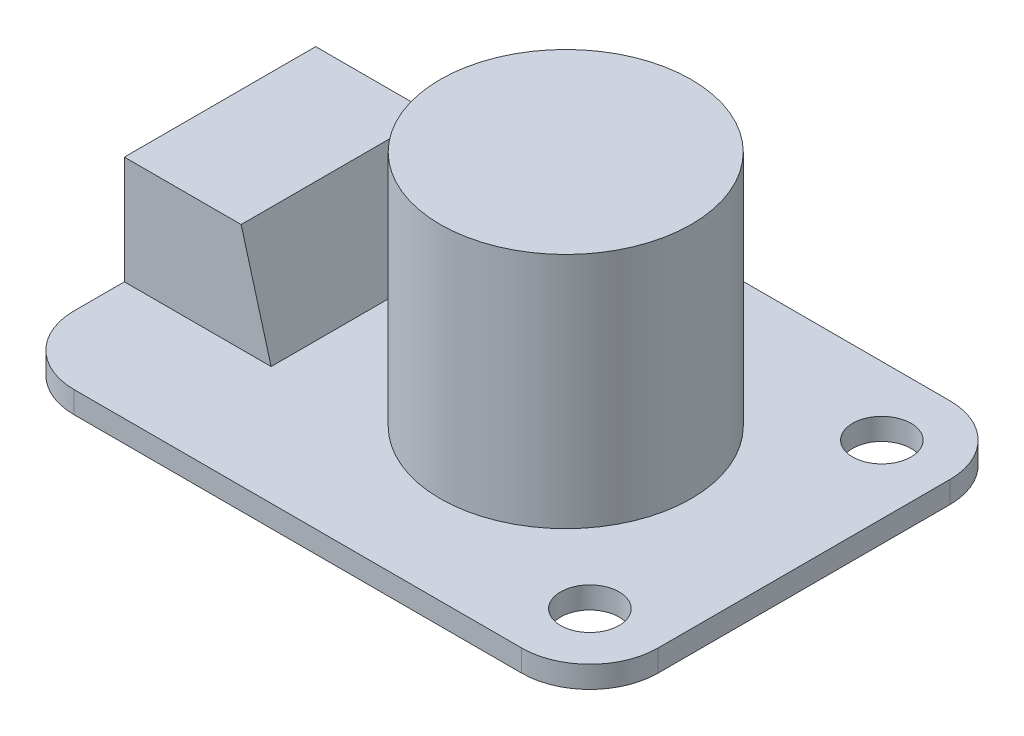
from build123d import *

# Parameters (mm, degrees)
SKETCH1_R           = 1.5
BOSS_EXTRUDE1_DEPTH = 1.12
SKETCH2_W           = 6
SKETCH2_H           = 9.83
BOSS_EXTRUDE2_DEPTH = 5.55
BOSS_EXTRUDE3_DEPTH = 9.83
SKETCH4_R           = 6.45
BOSS_EXTRUDE4_DEPTH = 12.2


with BuildPart() as part:
    # Sketch1 → Boss-Extrude1 (new body)
    with BuildSketch(Plane(origin=(0, 0, 0), x_dir=(1, 0, 0), z_dir=(0, 1, 0))):
        with BuildLine():
            Line((3.5, 0), (26.5, 0))
            ThreePointArc((26.5, 0), (28.974873734, 1.025126266), (30, 3.5))
            Line((30, 3.5), (30, 18.5))
            ThreePointArc((30, 18.5), (28.974873734, 20.974873734), (26.5, 22))
            Line((26.5, 22), (3.5, 22))
            ThreePointArc((3.5, 22), (1.025126266, 20.974873734), (0, 18.5))
            Line((0, 18.5), (0, 3.5))
            ThreePointArc((0, 3.5), (1.025126266, 1.025126266), (3.5, 0))
        make_face()
        with Locations(Location((26.5, 18.5, 0), (0, 0, 270))):
            Circle(SKETCH1_R, mode=Mode.SUBTRACT)
        with Locations(Location((26.5, 3.5, 0), (0, 0, 270))):
            Circle(SKETCH1_R, mode=Mode.SUBTRACT)
    extrude(amount=BOSS_EXTRUDE1_DEPTH)

    # Sketch2 → Boss-Extrude2 (add)
    with BuildSketch(Plane(origin=(0, 1.12, 0), x_dir=(1, 0, 0), z_dir=(0, 1, 0))):
        with Locations((3, 11)):
            Rectangle(SKETCH2_W, SKETCH2_H)
    extrude(amount=BOSS_EXTRUDE2_DEPTH)

    # Sketch3 → Boss-Extrude3 (add)
    with BuildSketch(Plane.XY.offset(-6.085)):
        Polygon((0, 1.12), (7.54, 1.12), (6, 6.67), (0, 6.67), align=None)
    extrude(amount=-BOSS_EXTRUDE3_DEPTH)

    # Sketch4 → Boss-Extrude4 (add)
    with BuildSketch(Plane(origin=(0, 1.12, 0), x_dir=(1, 0, 0), z_dir=(0, 1, 0))):
        with Locations(Location((17.76, 11, 0), (0, 0, 270))):
            Circle(SKETCH4_R)
    extrude(amount=BOSS_EXTRUDE4_DEPTH)


solid = part.part
